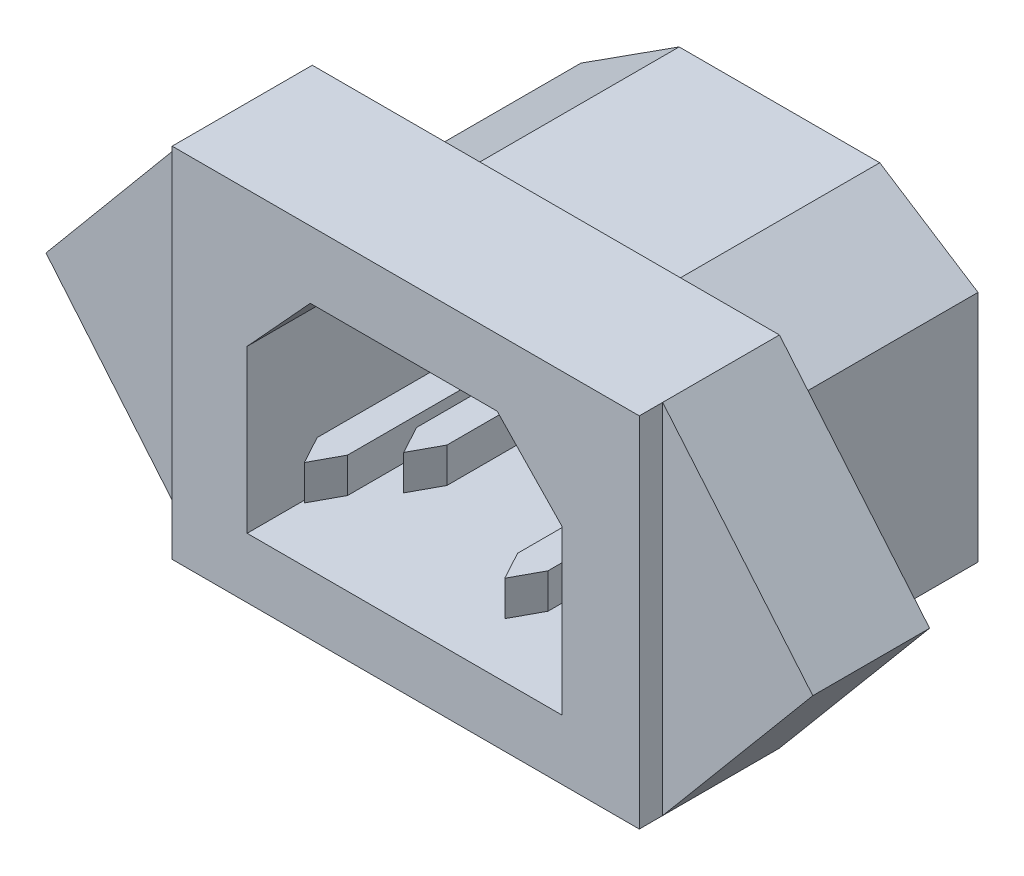
from build123d import *

# Parameters (mm, degrees)
BOSS_EXTRUDE1_DEPTH  = 5
SKETCH16_W           = 20
SKETCH16_H           = 15.320888863
BOSS_EXTRUDE8_DEPTH  = 1
BOSS_EXTRUDE9_DEPTH  = 10
CUT_EXTRUDE5_DEPTH   = 15
BOSS_EXTRUDE10_DEPTH = 1.5
BOSS_EXTRUDE11_DEPTH = 1.5
CUT_EXTRUDE6_REACH   = 57.591
SKETCH22_W           = 1.3
SKETCH22_H           = 1.5
SKETCH23_W           = 2.3
SKETCH23_H           = 3.5
BOSS_EXTRUDE12_DEPTH = 1.5
SKETCH24_W           = 2.3
SKETCH24_H           = 3.5
BOSS_EXTRUDE13_DEPTH = 1.5
SKETCH25_W           = 0.4
SKETCH25_H           = 2.5
BOSS_EXTRUDE14_DEPTH = 2
SKETCH26_W           = 0.4
SKETCH26_H           = 2.5
BOSS_EXTRUDE15_DEPTH = 2


with BuildPart() as part:
    # Sketch1 → Boss-Extrude1 (new body)
    with BuildSketch(Plane.XY):
        Polygon((-22.434902357, -6.600395702), (-16.00702626, -14.260840133), (-22.434902357, -21.921284565), (-42.434902357, -21.921284565), (-48.834902357, -14.260840133), (-42.434902357, -6.600395702), align=None)
    extrude(amount=BOSS_EXTRUDE1_DEPTH)

    # Sketch16 → Boss-Extrude8 (add)
    with BuildSketch(Plane.XY.offset(5)):
        with Locations((-32.434902357, -14.260840134)):
            Rectangle(SKETCH16_W, SKETCH16_H)
    extrude(amount=BOSS_EXTRUDE8_DEPTH)

    # Sketch17 → Boss-Extrude9 (add)
    with BuildSketch(Plane(origin=(0, 0, 0), x_dir=(-1, 0, 0), z_dir=(0, 0, -1))):
        Polygon((23.934902357, -10.772270445), (23.934902357, -20.772270445), (40.934902357, -20.772270445), (40.934902357, -10.772270445), (36.728990204, -8.068513251), (28.140814509, -8.068513251), align=None)
    extrude(amount=BOSS_EXTRUDE9_DEPTH)

    # Sketch18 → Cut-Extrude5 (cut)
    with BuildSketch(Plane.XY.offset(6)):
        Polygon((-36.52114033, -9.469193937), (-28.52114033, -9.469193937), (-25.745192181, -12.349143915), (-25.745192181, -19.349565181), (-39.224780036, -19.349565181), (-39.224780036, -12.417130901), align=None)
    extrude(amount=-CUT_EXTRUDE5_DEPTH, mode=Mode.SUBTRACT)

    # Sketch19 → Boss-Extrude10 (add)
    with BuildSketch(Plane(origin=(0, -17, 0), x_dir=(1, 0, 0), z_dir=(0, 1, 0))):
        Polygon((-27.545192181, 9), (-28.845192181, 9), (-28.845192181, -4.8), (-28.195192181, -6), (-27.545192181, -4.8), align=None)
        Polygon((-36.124780036, 9), (-37.424780036, 9), (-37.424780036, -4.8), (-36.774780036, -6), (-36.124780036, -4.8), align=None)
    extrude(amount=BOSS_EXTRUDE10_DEPTH)

    # Sketch20 → Boss-Extrude11 (add)
    with BuildSketch(Plane(origin=(0, -13, 0), x_dir=(-1, 0, 0), z_dir=(0, -1, 0))):
        Polygon((33.17114033, 9), (31.87114033, 9), (31.87114033, -4.8), (32.52114033, -6), (33.17114033, -4.8), align=None)
    extrude(amount=BOSS_EXTRUDE11_DEPTH)

    # Sketch22 → Cut-Extrude6 (cut, up to next)
    with BuildSketch(Plane.XY.offset(-9), mode=Mode.PRIVATE) as cut_extrude6_sk1:
        with Locations((-28.195192181, -16.25)):
            Rectangle(SKETCH22_W, SKETCH22_H)
    cut_extrude6_tool1 = extrude(cut_extrude6_sk1.sketch, amount=-CUT_EXTRUDE6_REACH, mode=Mode.PRIVATE) & part.part
    # Sketch22 → Cut-Extrude6 (cut, up to next)
    with BuildSketch(Plane.XY.offset(-9), mode=Mode.PRIVATE) as cut_extrude6_sk2:
        with Locations((-32.52114033, -13.75)):
            Rectangle(SKETCH22_W, SKETCH22_H)
    cut_extrude6_tool2 = extrude(cut_extrude6_sk2.sketch, amount=-CUT_EXTRUDE6_REACH, mode=Mode.PRIVATE) & part.part
    # Sketch22 → Cut-Extrude6 (cut, up to next)
    with BuildSketch(Plane.XY.offset(-9), mode=Mode.PRIVATE) as cut_extrude6_sk3:
        with Locations((-36.774780036, -16.25)):
            Rectangle(SKETCH22_W, SKETCH22_H)
    cut_extrude6_tool3 = extrude(cut_extrude6_sk3.sketch, amount=-CUT_EXTRUDE6_REACH, mode=Mode.PRIVATE) & part.part
    add(cut_extrude6_tool1.solids().sort_by_distance((-28.195192, -16.25, -9))[0], mode=Mode.SUBTRACT)
    add(cut_extrude6_tool2.solids().sort_by_distance((-32.52114, -13.75, -9))[0], mode=Mode.SUBTRACT)
    add(cut_extrude6_tool3.solids().sort_by_distance((-36.77478, -16.25, -9))[0], mode=Mode.SUBTRACT)


with BuildPart() as cut_extrude6_piece_1:
    # of the separate pieces the step leaves, piece 1, a body of its own (cut_extrude6_pieces)
    add(part.part.solids().sort_by_distance((-22.434902357, -6.600395702, 0))[0])

    # Sketch23 → Boss-Extrude12 (add)
    with BuildSketch(Plane(origin=(0, 0, -10), x_dir=(-1, 0, 0), z_dir=(0, 0, -1))):
        with Locations((36.75436789, -16.25)):
            Rectangle(SKETCH23_W, SKETCH23_H)
        with Locations((28.195192181, -16.25)):
            Rectangle(SKETCH23_W, SKETCH23_H)
    extrude(amount=BOSS_EXTRUDE12_DEPTH)

    # Sketch24 → Boss-Extrude13 (add)
    with BuildSketch(Plane(origin=(0, 0, -10), x_dir=(-1, 0, 0), z_dir=(0, 0, -1))):
        with Locations((32.52114033, -13.75)):
            Rectangle(SKETCH24_W, SKETCH24_H)
    extrude(amount=BOSS_EXTRUDE13_DEPTH)

    # Sketch25 → Boss-Extrude14 (add)
    with BuildSketch(Plane(origin=(0, 0, -11.5), x_dir=(-1, 0, 0), z_dir=(0, 0, -1))):
        with Locations((32.52114033, -13.75)):
            Rectangle(SKETCH25_W, SKETCH25_H)
    extrude(amount=BOSS_EXTRUDE14_DEPTH)

    # Sketch26 → Boss-Extrude15 (add)
    with BuildSketch(Plane(origin=(0, 0, -11.5), x_dir=(-1, 0, 0), z_dir=(0, 0, -1))):
        with Locations((36.75436789, -16.25)):
            Rectangle(SKETCH26_W, SKETCH26_H)
        with Locations((28.195188324, -16.25)):
            Rectangle(SKETCH26_W, SKETCH26_H)
    extrude(amount=BOSS_EXTRUDE15_DEPTH)


with BuildPart() as cut_extrude6_piece_2:
    # of the separate pieces the step leaves, piece 2, a body of its own (cut_extrude6_pieces)
    add(part.part.solids().sort_by_distance((-37.424780036, -17, 4.8))[0])


with BuildPart() as cut_extrude6_piece_3:
    # of the separate pieces the step leaves, piece 3, a body of its own (cut_extrude6_pieces)
    add(part.part.solids().sort_by_distance((-31.87114033, -13, 4.8))[0])


with BuildPart() as cut_extrude6_piece_4:
    # of the separate pieces the step leaves, piece 4, a body of its own (cut_extrude6_pieces)
    add(part.part.solids().sort_by_distance((-28.845192181, -17, 4.8))[0])


solid = Compound([cut_extrude6_piece_1.part, cut_extrude6_piece_2.part, cut_extrude6_piece_3.part, cut_extrude6_piece_4.part])
